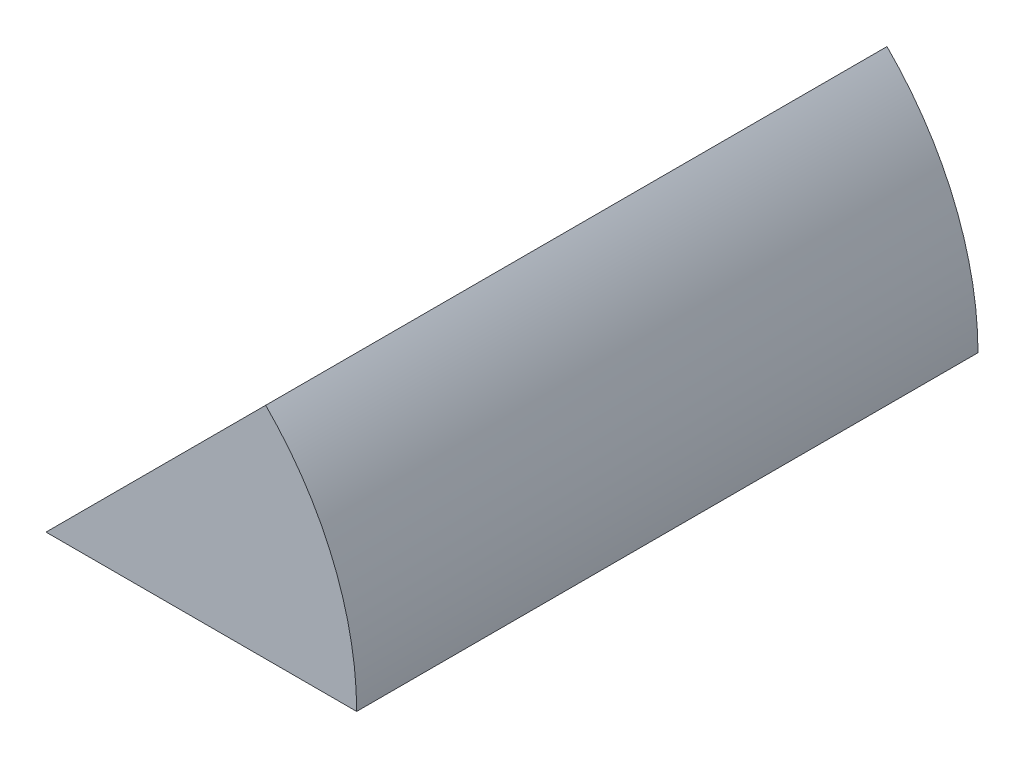
from build123d import *

# Parameters (mm, degrees)
SALIENTE_EXTRUIR1_DEPTH = 50
CROQUIS2_R              = 5
CORTAR_EXTRUIR1_DEPTH   = 10


with BuildPart() as part:
    # Croquis1 → Saliente-Extruir1 (new body)
    with BuildSketch(Plane.XY):
        with BuildLine():
            Line((0, 0), (25, 0))
            ThreePointArc((25, 0), (23.096988313, 9.567085809), (17.67766953, 17.67766953))
            Line((17.67766953, 17.67766953), (0, 0))
        make_face()
    extrude(amount=SALIENTE_EXTRUIR1_DEPTH)

    # Croquis2 → Cortar-Extruir1 (cut)
    with BuildSketch(Plane(origin=(0, 0, 0), x_dir=(-1, 0, 0), z_dir=(0, 0, -1))):
        with Locations((-16.672339889, 6.674072093)):
            Circle(CROQUIS2_R)
    extrude(amount=-CORTAR_EXTRUIR1_DEPTH, mode=Mode.SUBTRACT)


solid = part.part
